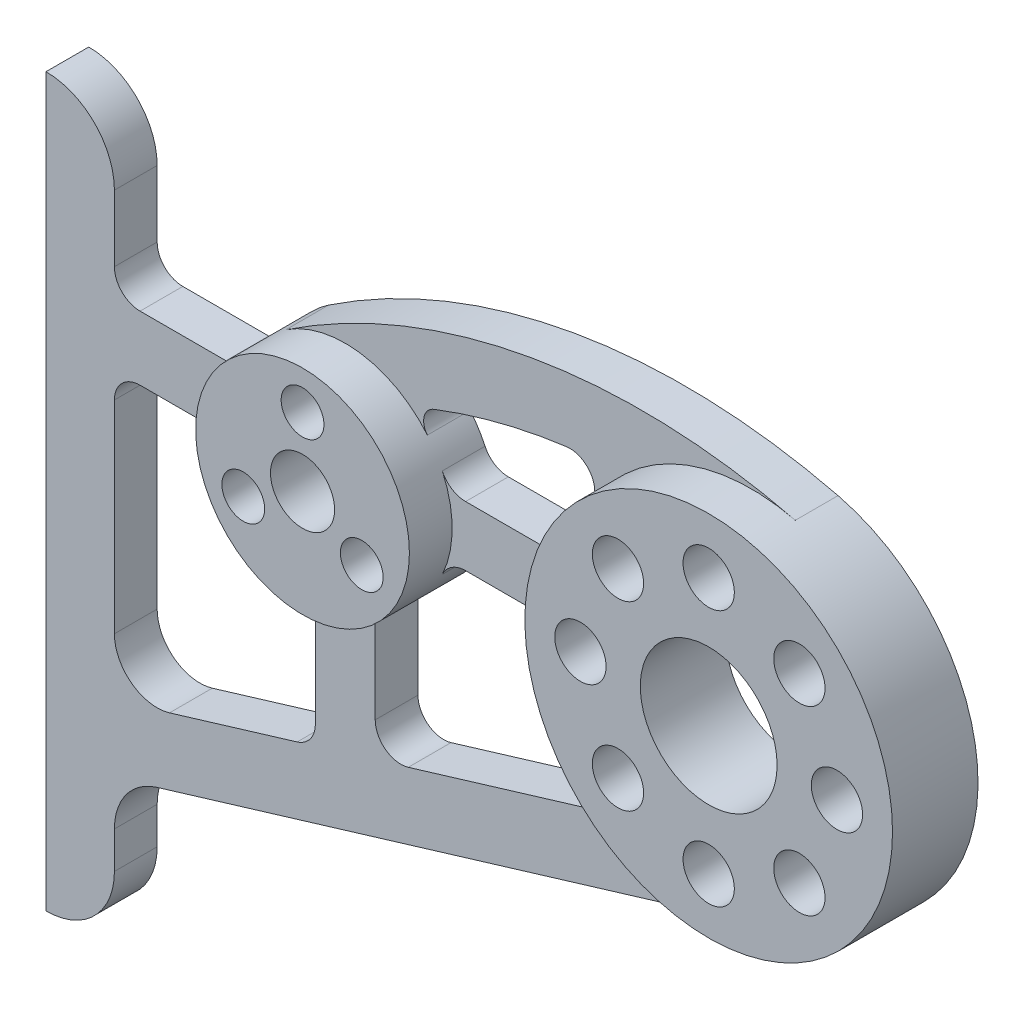
from build123d import *

# Parameters (mm, degrees)
EXTRUDE_1_DEPTH   = 10
EXTRUDE_1_2_DEPTH = 10
EXTRUDE_1_3_DEPTH = 10
SKETCH_1_3_R      = 43
SKETCH_1_3_R_2    = 6
SKETCH_1_3_R_3    = 16
SKETCH_1_3_R_4    = 25
SKETCH_1_3_R_5    = 5
SKETCH_1_3_R_6    = 7.5
EXTRUDE_2_DEPTH   = 20


with BuildPart() as part:
    # Эскиз1 → Бобышка-Вытянуть1 (new body)
    with BuildSketch(Plane.XY):
        with BuildLine():
            ThreePointArc((-54, 29), (-58.686291501, 40.313708499), (-70, 45))
            Line((-70, 45), (-70, -125))
            ThreePointArc((-70, -125), (-58.686291501, -120.313708499), (-54, -109))
            Line((-54, -109), (-54, -100.391329163))
            ThreePointArc((-54, -100.391329163), (-51.241745904, -92.047280445), (-44.053835854, -86.991089805))
            Line((-44.053835854, -86.991089805), (107.451067266, -41.15787803))
            ThreePointArc((107.451067266, -41.15787803), (81.540043629, -40.839069217), (60.517137347, -25.689145242))
            ThreePointArc((60.517137347, -25.689145242), (61.99532492, -34.793587478), (55.393464002, -41.234964608))
            Line((55.393464002, -41.234964608), (14.737358223, -53.534235903))
            ThreePointArc((14.737358223, -53.534235903), (9.423979121, -52.60916728), (7, -47.791276178))
            Line((7, -47.791276178), (7, -28.142494559))
            ThreePointArc((7, -28.142494559), (7.945458765, -24.909599122), (10.483870968, -22.695560128))
            ThreePointArc((10.483870968, -22.695560128), (0, -25), (-10.483870968, -22.695560128))
            ThreePointArc((-10.483870968, -22.695560128), (-7.945458765, -24.909599122), (-7, -28.142494559))
            Line((-7, -28.142494559), (-7, -55.656787337))
            ThreePointArc((-7, -55.656787337), (-8.182108898, -59.232808217), (-11.262641777, -61.399747063))
            Line((-11.262641777, -61.399747063), (-41.104402961, -70.427466509))
            ThreePointArc((-41.104402961, -70.427466509), (-49.960034799, -68.88568547), (-54, -60.855866967))
            Line((-54, -60.855866967), (-54, -13.5))
            ThreePointArc((-54, -13.5), (-52.242640687, -9.257359313), (-48, -7.5))
            Line((-48, -7.5), (-27.906092525, -7.5))
            ThreePointArc((-27.906092525, -7.5), (-24.718414636, -8.416820908), (-22.504913326, -10.887096774))
            ThreePointArc((-22.504913326, -10.887096774), (-25, 0), (-22.504913326, 10.887096774))
            ThreePointArc((-22.504913326, 10.887096774), (-24.718414636, 8.416820908), (-27.906092525, 7.5))
            Line((-27.906092525, 7.5), (-48, 7.5))
            ThreePointArc((-48, 7.5), (-52.242640687, 9.257359313), (-54, 13.5))
            Line((-54, 13.5), (-54, 29))
        make_face()
    extrude(amount=EXTRUDE_1_DEPTH)



with BuildPart() as body_2:
    # Эскиз1 → Extrude 1 2 (new body)
    with BuildSketch(Plane.XY):
        with BuildLine():
            ThreePointArc((105.256123955, 41.758974142), (43.471517996, 43.816308869), (-13.895789474, 20.782373178))
            ThreePointArc((-13.895789474, 20.782373178), (3.574397154, 24.743154306), (19.209372712, 16))
            ThreePointArc((19.209372712, 16), (18.448719356, 19.393999935), (20.761928319, 21.991478208))
            ThreePointArc((20.761928319, 21.991478208), (36.009186006, 26.873359096), (51.727153653, 29.915910824))
            ThreePointArc((51.727153653, 29.915910824), (57.357710528, 27.382727589), (57.596791581, 21.213203436))
            ThreePointArc((57.596791581, 21.213203436), (77.977273362, 39.487045696), (105.256123955, 41.758974142))
        make_face()
    extrude(amount=EXTRUDE_1_2_DEPTH)


with BuildPart() as body_3:
    # Эскиз1 → Extrude 1 3 (new body)
    with BuildSketch(Plane.XY):
        with BuildLine():
            ThreePointArc((47.755952756, -7), (51.392501916, -8.227630546), (53.540938133, -11.408163265))
            ThreePointArc((53.540938133, -11.408163265), (52, 0), (53.540938133, 11.408163265))
            ThreePointArc((53.540938133, 11.408163265), (51.392501916, 8.227630546), (47.755952756, 7))
            Line((47.755952756, 7), (28.142494559, 7))
            ThreePointArc((28.142494559, 7), (24.909599122, 7.945458765), (22.695560128, 10.483870968))
            ThreePointArc((22.695560128, 10.483870968), (25, 0), (22.695560128, -10.483870968))
            ThreePointArc((22.695560128, -10.483870968), (24.909599122, -7.945458765), (28.142494559, -7))
            Line((28.142494559, -7), (47.755952756, -7))
        make_face()
    extrude(amount=EXTRUDE_1_3_DEPTH)


with BuildPart() as part_1:
    add(part.part)

    add(body_2.part)  # Бобышка-Вытянуть2 merges body 2

    add(body_3.part)  # Бобышка-Вытянуть2 merges body 3
    # Эскиз1<3> → Бобышка-Вытянуть2 (add)
    # profile 1 of 2: a face of its own
    with BuildSketch(Plane.XY):
        with Locations((95, 0)):
            Circle(SKETCH_1_3_R)
        with Locations((73.786796564, -21.213203436)):
            Circle(SKETCH_1_3_R_2, mode=Mode.SUBTRACT)
        with Locations((65, 0)):
            Circle(SKETCH_1_3_R_2, mode=Mode.SUBTRACT)
        with Locations((95, -30)):
            Circle(SKETCH_1_3_R_2, mode=Mode.SUBTRACT)
        with Locations((116.213203436, -21.213203436)):
            Circle(SKETCH_1_3_R_2, mode=Mode.SUBTRACT)
        with Locations((95, 0)):
            Circle(SKETCH_1_3_R_3, mode=Mode.SUBTRACT)
        with Locations((125, 0)):
            Circle(SKETCH_1_3_R_2, mode=Mode.SUBTRACT)
        with Locations((73.786796564, 21.213203436)):
            Circle(SKETCH_1_3_R_2, mode=Mode.SUBTRACT)
        with Locations((116.213203436, 21.213203436)):
            Circle(SKETCH_1_3_R_2, mode=Mode.SUBTRACT)
        with Locations((95, 30)):
            Circle(SKETCH_1_3_R_2, mode=Mode.SUBTRACT)
    # profile 2 of 2: a face of its own
    with BuildSketch(Plane.XY):
        Circle(SKETCH_1_3_R_4)
        with Locations((-13.856406461, -8)):
            Circle(SKETCH_1_3_R_5, mode=Mode.SUBTRACT)
        Circle(SKETCH_1_3_R_6, mode=Mode.SUBTRACT)
        with Locations((13.856406461, -8)):
            Circle(SKETCH_1_3_R_5, mode=Mode.SUBTRACT)
        with Locations((0, 16)):
            Circle(SKETCH_1_3_R_5, mode=Mode.SUBTRACT)
    extrude(amount=EXTRUDE_2_DEPTH)


solid = part_1.part
